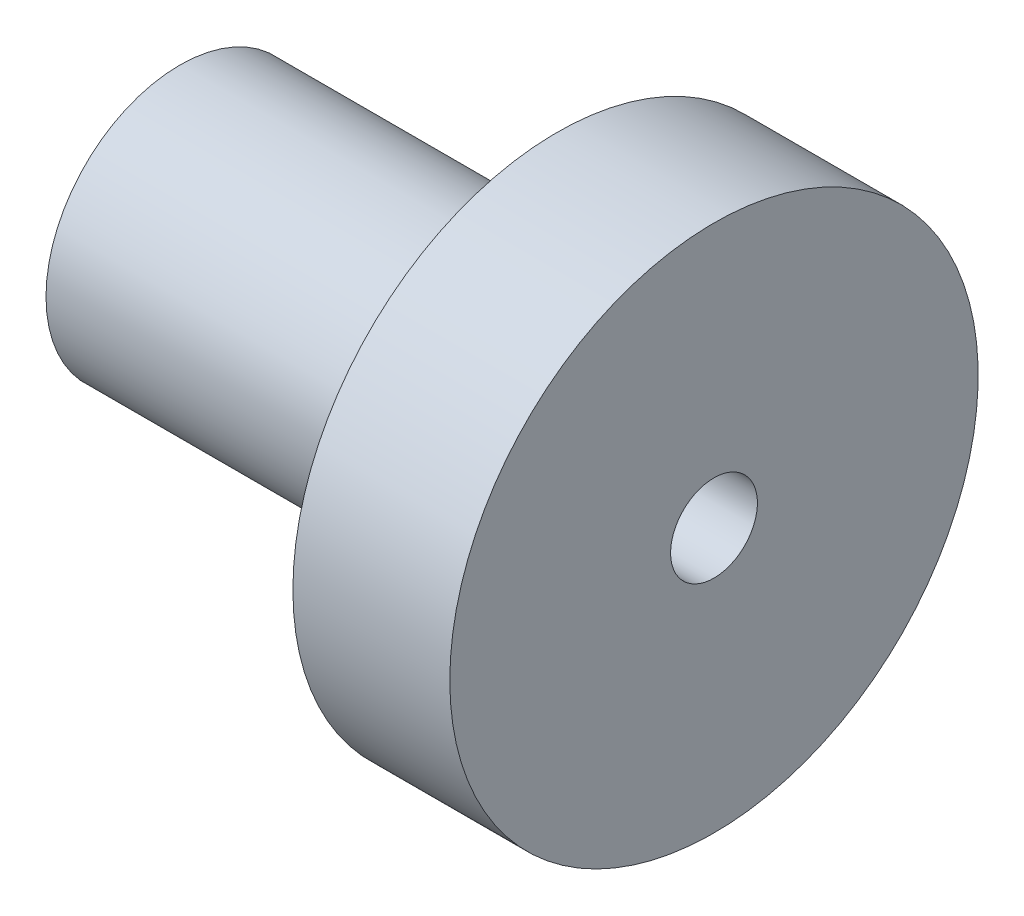
from build123d import *

# Parameters (mm, degrees)
SKETCH_2_R          = 7.795868549
CUT_EXTRUDE_1_DEPTH = 118.024086346


with BuildPart() as part:
    # 草图1 → 旋转1 (revolve)
    with BuildSketch(Plane.XY, mode=Mode.PRIVATE) as revolve_1_sk:
        Polygon((67.726226486, 47.429069924), (67.726226486, 24.025205726), (0, 24.025205726), (0, 0), (67.726226486, 0), (95.893709061, 0), (95.893709061, 47.429069924), align=None)
    revolve(revolve_1_sk.sketch.rotate(Axis((0, 0, 0), (1, 0, 0)), 90), axis=Axis((0, 0, 0), (1, 0, 0)))

    # 草图2 → 切除-拉伸1 (cut, through all)
    with BuildSketch(Plane.ZY):
        Circle(SKETCH_2_R)
    extrude(amount=-CUT_EXTRUDE_1_DEPTH, mode=Mode.SUBTRACT)


solid = part.part
